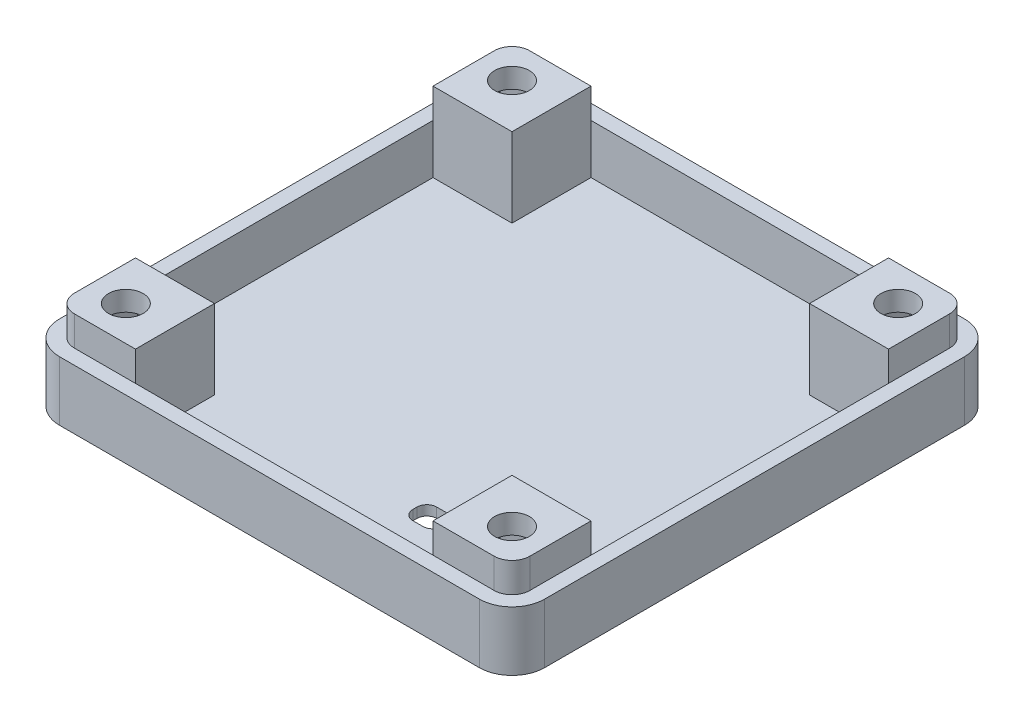
from build123d import *

# Parameters (mm, degrees)
EXTRUDE_1_DEPTH     = 6
SKETCH_1_3_R        = 1.75
EXTRUDE_1_2_DEPTH   = 9
CUT_EXTRUDE_1_DEPTH = 7
SKETCH_3_W          = 7.976009827
SKETCH_3_H          = 30.047980346
SKETCH_3_W_2        = 30.047980346
SKETCH_3_H_2        = 7.976009827
CUT_EXTRUDE_2_DEPTH = 8
CUT_EXTRUDE_3_DEPTH = 5


with BuildPart() as part:
    # 草图1 → Extrude 1 (new body)
    with BuildSketch(Plane(origin=(0, 0, 0), x_dir=(1, 0, 0), z_dir=(0, 1, 0))):
        with BuildLine():
            Line((-24.5, 21.2), (-24.5, -21.2))
            ThreePointArc((-24.5, -21.2), (-23.533452378, -23.533452378), (-21.2, -24.5))
            Line((-21.2, -24.5), (21.2, -24.5))
            ThreePointArc((21.2, -24.5), (23.533452378, -23.533452378), (24.5, -21.2))
            Line((24.5, -21.2), (24.5, 21.2))
            ThreePointArc((24.5, 21.2), (23.533452378, 23.533452378), (21.2, 24.5))
            Line((21.2, 24.5), (-21.2, 24.5))
            ThreePointArc((-21.2, 24.5), (-23.533452378, 23.533452378), (-24.5, 21.2))
        make_face()
        with BuildLine():
            Line((-23, 21.2), (-23, -21.2))
            ThreePointArc((-23, -21.2), (-22.472792206, -22.472792206), (-21.2, -23))
            Line((-21.2, -23), (21.2, -23))
            ThreePointArc((21.2, -23), (22.472792206, -22.472792206), (23, -21.2))
            Line((23, -21.2), (23, 21.2))
            ThreePointArc((23, 21.2), (22.472792206, 22.472792206), (21.2, 23))
            Line((21.2, 23), (-21.2, 23))
            ThreePointArc((-21.2, 23), (-22.472792206, 22.472792206), (-23, 21.2))
        make_face(mode=Mode.SUBTRACT)
    extrude(amount=EXTRUDE_1_DEPTH)

    # 草图1<3> → Extrude 1 2 (add)
    with BuildSketch(Plane(origin=(0, 0, 0), x_dir=(1, 0, 0), z_dir=(0, 1, 0))):
        with BuildLine():
            Line((-21.2, -23), (21.2, -23))
            ThreePointArc((21.2, -23), (22.472792206, -22.472792206), (23, -21.2))
            Line((23, -21.2), (23, 21.2))
            ThreePointArc((23, 21.2), (22.472792206, 22.472792206), (21.2, 23))
            Line((21.2, 23), (-21.2, 23))
            ThreePointArc((-21.2, 23), (-22.472792206, 22.472792206), (-23, 21.2))
            Line((-23, 21.2), (-23, -21.2))
            ThreePointArc((-23, -21.2), (-22.472792206, -22.472792206), (-21.2, -23))
        make_face()
        with Locations(Location((-19.5, 19.5, 0), (0, 0, 270))):
            Circle(SKETCH_1_3_R, mode=Mode.SUBTRACT)
        with Locations(Location((19.5, 19.5, 0), (0, 0, 270))):
            Circle(SKETCH_1_3_R, mode=Mode.SUBTRACT)
        with Locations(Location((19.5, -19.5, 0), (0, 0, 270))):
            Circle(SKETCH_1_3_R, mode=Mode.SUBTRACT)
        with Locations(Location((-19.5, -19.5, 0), (0, 0, 270))):
            Circle(SKETCH_1_3_R, mode=Mode.SUBTRACT)
    extrude(amount=EXTRUDE_1_2_DEPTH)

    # 草图2 → 切除-拉伸1 (cut)
    with BuildSketch(Plane.XZ):
        Polygon((22.35, 17.854551733), (22.35, 21.145448267), (19.5, 22.790896534), (16.65, 21.145448267), (16.65, 17.854551733), (19.5, 16.209103466), align=None)
        Polygon((-17.854551733, 22.35), (-21.145448267, 22.35), (-22.790896534, 19.5), (-21.145448267, 16.65), (-17.854551733, 16.65), (-16.209103466, 19.5), align=None)
        Polygon((17.854551733, -22.35), (21.145448267, -22.35), (22.790896534, -19.5), (21.145448267, -16.65), (17.854551733, -16.65), (16.209103466, -19.5), align=None)
        Polygon((-22.35, -17.854551733), (-22.35, -21.145448267), (-19.5, -22.790896534), (-16.65, -21.145448267), (-16.65, -17.854551733), (-19.5, -16.209103466), align=None)
    extrude(amount=-CUT_EXTRUDE_1_DEPTH, mode=Mode.SUBTRACT)

    # 草图3 → 切除-拉伸2 (cut)
    with BuildSketch(Plane(origin=(0, 9, 0), x_dir=(1, 0, 0), z_dir=(0, 1, 0))):
        with Locations((19.011995087, 0)):
            Rectangle(SKETCH_3_W, SKETCH_3_H)
        with Locations((0, 19.011995087)):
            Rectangle(SKETCH_3_W_2, SKETCH_3_H_2)
        Rectangle(SKETCH_3_W_2, SKETCH_3_H)
        with Locations((0, -19.011995087)):
            Rectangle(SKETCH_3_W_2, SKETCH_3_H_2)
        with Locations((-19.011995087, 0)):
            Rectangle(SKETCH_3_W, SKETCH_3_H)
    extrude(amount=-CUT_EXTRUDE_2_DEPTH, mode=Mode.SUBTRACT)

    # 草图5 → 切除-拉伸3 (cut)
    with BuildSketch(Plane(origin=(0, 0, 0), x_dir=(-1, 0, 0), z_dir=(0, -1, 0))):
        with BuildLine():
            Line((-6, -13.6), (-7, -13.6))
            ThreePointArc((-7, -13.6), (-7.707106781, -13.892893219), (-8, -14.6))
            Line((-8, -14.6), (-8, -15))
            ThreePointArc((-8, -15), (-7.707106781, -15.707106781), (-7, -16))
            Line((-7, -16), (-6, -16))
            ThreePointArc((-6, -16), (-5.292893219, -15.707106781), (-5, -15))
            Line((-5, -15), (-5, -14.6))
            ThreePointArc((-5, -14.6), (-5.292893219, -13.892893219), (-6, -13.6))
        make_face()
    extrude(amount=-CUT_EXTRUDE_3_DEPTH, mode=Mode.SUBTRACT)


solid = part.part
